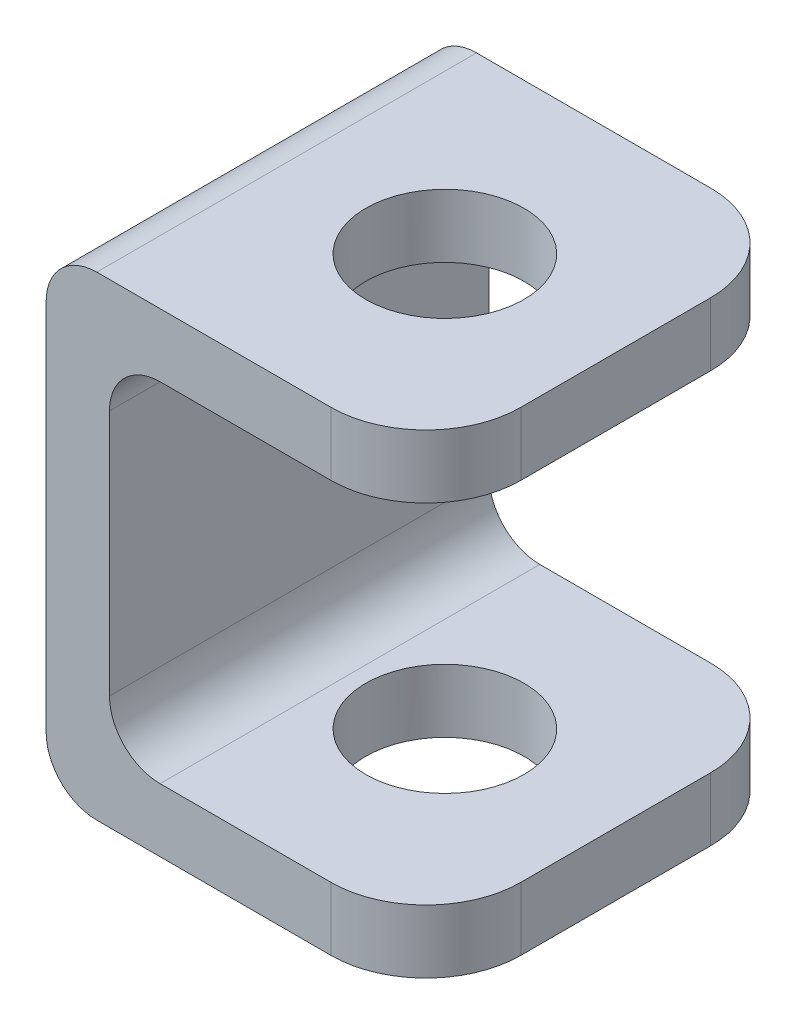
from build123d import *

# Parameters (mm, degrees)
BOSS_EXTRUDE1_DEPTH = 60
FILLET1_R           = 15
FILLET2_R           = 8
SKETCH2_R           = 12.5
CUT_EXTRUDE1_DEPTH  = 100
SKETCH4_W           = 25.4
SKETCH4_H           = 25.4
CUT_EXTRUDE2_DEPTH  = 0.1


with BuildPart() as part:
    # Sketch1 → Boss-Extrude1 (new body)
    with BuildSketch(Plane.XY):
        Polygon((0, -37.5), (0, 37.5), (60, 37.5), (60, 27.5), (10, 27.5), (10, -27.5), (60, -27.5), (60, -37.5), align=None)
    extrude(amount=BOSS_EXTRUDE1_DEPTH)

    # Fillet1
    fillet1_edges = [part.edges().sort_by_distance(p)[0] for p in [
        (60, -32.5, 0),
        (60, -32.5, 60),
        (60, 32.5, 60),
        (60, 32.5, 0),
    ]]
    fillet(fillet1_edges, radius=FILLET1_R)

    # Fillet2
    fillet2_edges = [part.edges().sort_by_distance(p)[0] for p in [
        (10, 27.5, 30),
        (10, -27.5, 30),
        (0, -37.5, 30),
        (0, 37.5, 30),
    ]]
    fillet(fillet2_edges, radius=FILLET2_R)

    # Sketch2 → Cut-Extrude1 (cut)
    with BuildSketch(Plane(origin=(0, 37.5, 0), x_dir=(1, 0, 0), z_dir=(0, 1, 0))):
        with Locations(Location((33, -30, 0), (0, 0, 270))):
            Circle(SKETCH2_R)
    extrude(amount=-CUT_EXTRUDE1_DEPTH, mode=Mode.SUBTRACT)

    # Sketch4 → Cut-Extrude2 (cut)
    with BuildSketch(Plane.ZY):
        with Locations((30, 0)):
            Rectangle(SKETCH4_W, SKETCH4_H)
    extrude(amount=-CUT_EXTRUDE2_DEPTH, mode=Mode.SUBTRACT)


solid = part.part
